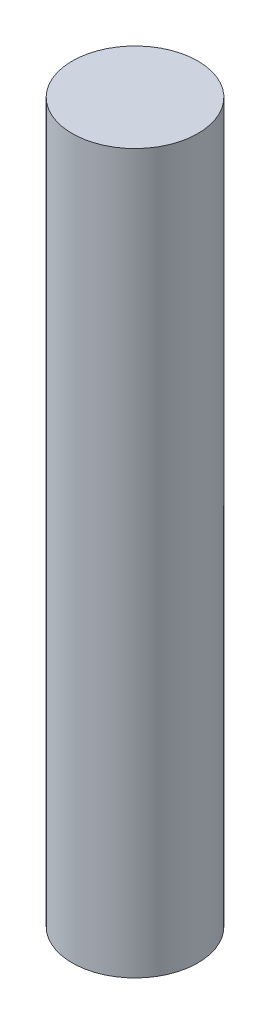
from build123d import *

# Parameters (mm, degrees)
SKETCH1_R           = 2.667
BOSS_EXTRUDE1_DEPTH = 30.48


with BuildPart() as part:
    # Sketch1 → Boss-Extrude1 (new body)
    with BuildSketch(Plane(origin=(0, 0, 0), x_dir=(1, 0, 0), z_dir=(0, 1, 0))):
        with Locations(Location((0, 0, 0), (0, 0, 90))):
            Circle(SKETCH1_R)
    extrude(amount=BOSS_EXTRUDE1_DEPTH)


solid = part.part
